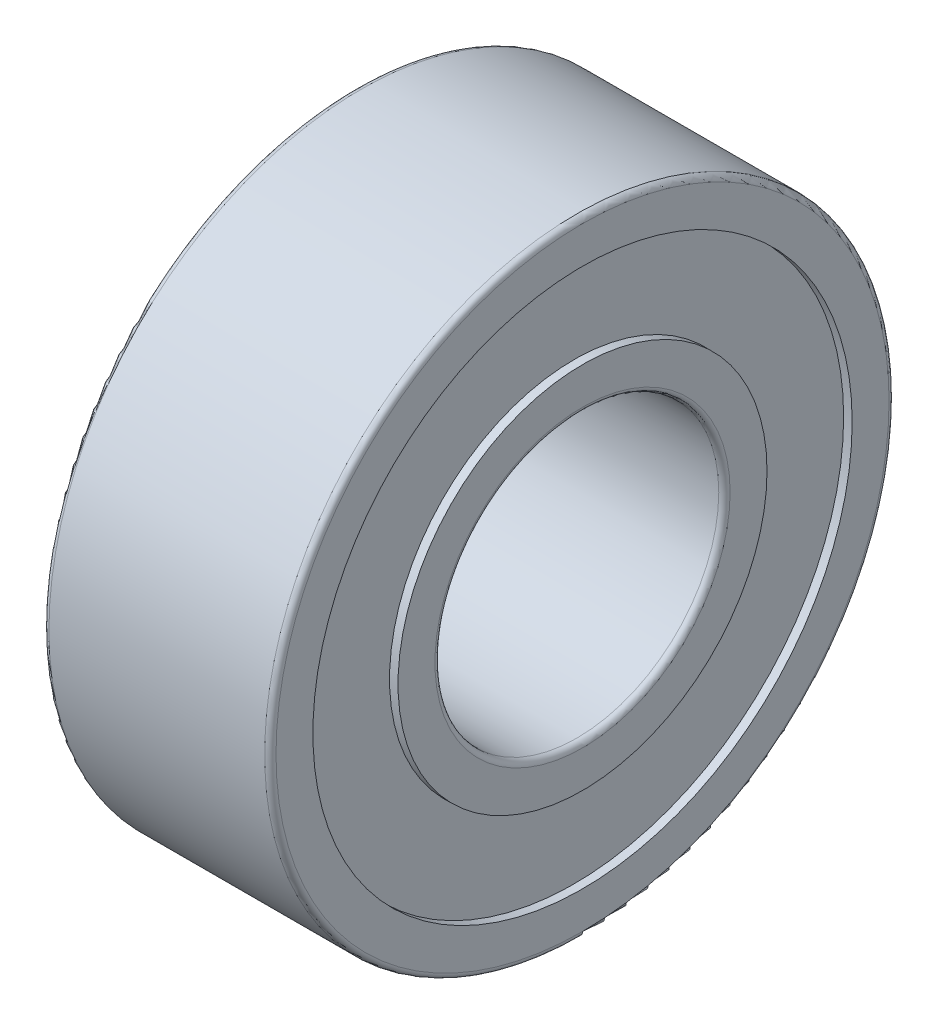
from build123d import *

# Parameters (mm, degrees)
FILLET1_R = 0.2


with BuildPart() as part:
    # Sketch1 → Revolve1 (revolve)
    with BuildSketch(Plane.XY, mode=Mode.PRIVATE) as revolve1_sk:
        Polygon((4, 5), (-4, 5), (-4, 6.5), (-3.7, 6.5), (-3.7, 9.5), (-4, 9.5), (-4, 11), (4, 11), (4, 9.5), (3.7, 9.5), (3.7, 6.5), (4, 6.5), align=None)
    revolve(revolve1_sk.sketch.rotate(Axis((0, 0, 0), (-1, 0, 0)), 90), axis=Axis((0, 0, 0), (-1, 0, 0)))

    # Fillet1
    fillet1_edges = [part.edges().sort_by_distance(p)[0] for p in [
        (4, 0, 11),
        (-4, 0, 11),
        (-4, 0, 5),
        (4, 0, 5),
    ]]
    fillet(fillet1_edges, radius=FILLET1_R)


solid = part.part
